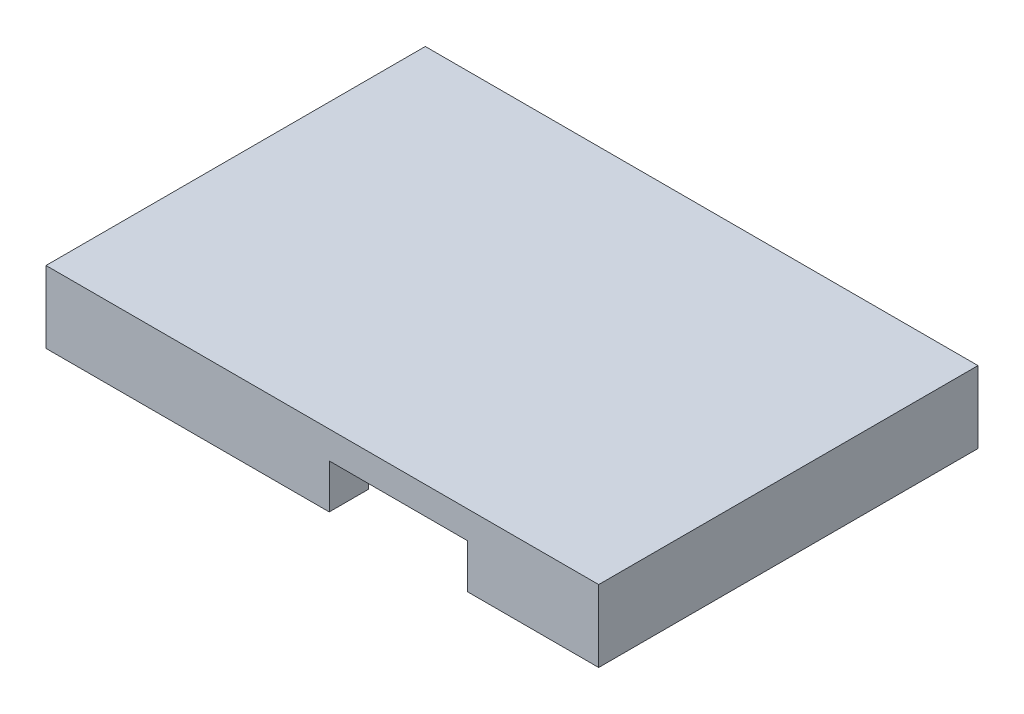
from build123d import *

# Parameters (mm, degrees)
BOSS_EXTRUDE1_DEPTH = 3.2
SKETCH2_W           = 40
SKETCH2_H           = 27.451745852
BOSS_EXTRUDE2_DEPTH = 2


with BuildPart() as part:
    # Sketch1 → Boss-Extrude1 (new body)
    with BuildSketch(Plane(origin=(0, 0, 0), x_dir=(1, 0, 0), z_dir=(0, 1, 0))):
        Polygon((10.5, -10.873040155), (10.5, -13.725872926), (20, -13.725872926), (20, 13.725872926), (-20, 13.725872926), (-20, -13.725872926), (0.5, -13.725872926), (0.5, -10.873040155), (-11.5, -10.873040155), (-11.5, -6.873040155), (-16, -6.873040155), (-16, -4.873040155), (-11.5, -4.873040155), (-11.5, 10.626959845), (11.5, 10.626959845), (11.5, -4.873040155), (16, -4.873040155), (16, -6.873040155), (11.5, -6.873040155), (11.5, -10.873040155), align=None)
    extrude(amount=BOSS_EXTRUDE1_DEPTH)

    # Sketch2 → Boss-Extrude2 (add)
    with BuildSketch(Plane(origin=(0, 3.2, 0), x_dir=(1, 0, 0), z_dir=(0, 1, 0))):
        Rectangle(SKETCH2_W, SKETCH2_H)
    extrude(amount=BOSS_EXTRUDE2_DEPTH)


solid = part.part
